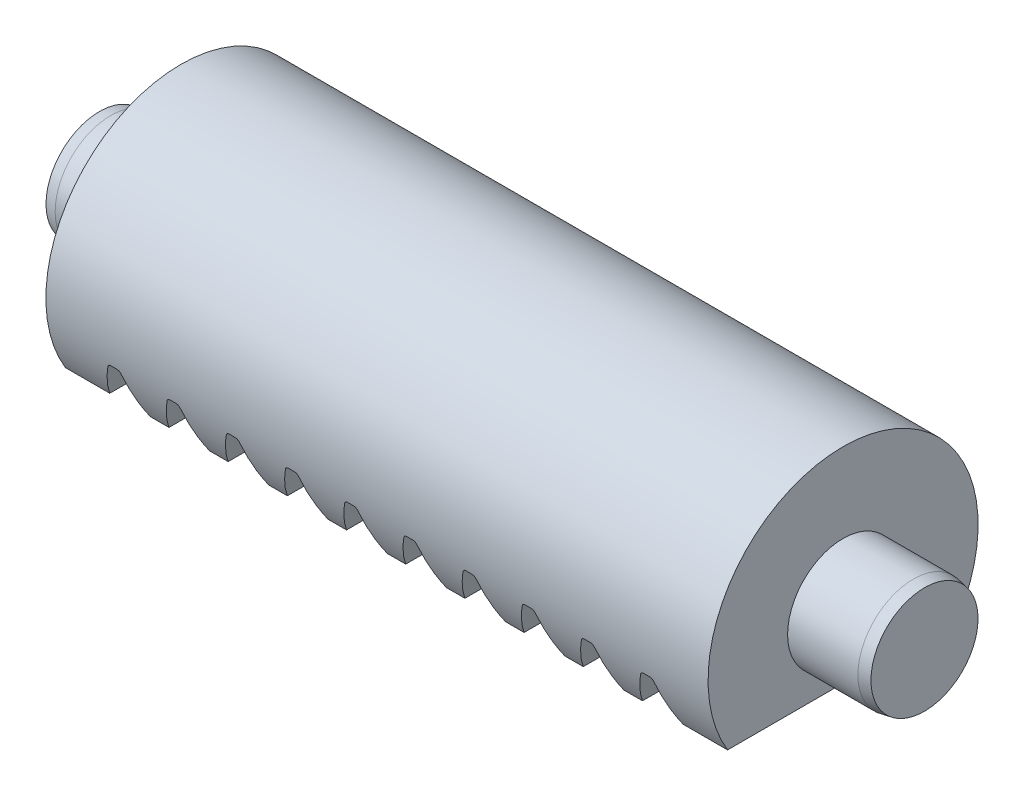
from build123d import *

# Parameters (mm, degrees)
CUT_EXTRUDE_1_DEPTH      = 123.8688325
CUT_EXTRUDE_1_DEPTH_BACK = 123.8688325
SKETCH_2_W               = 179
SKETCH_2_H               = 17.6
CUT_EXTRUDE_2_DEPTH      = 123.8688325
PATTERN_LINEAR_1_COUNT   = 10
PATTERN_LINEAR_1_PITCH   = 16


with BuildPart() as part:
    # Эскиз1 → Повернуть1 (revolve)
    with BuildSketch(Plane.XY, mode=Mode.PRIVATE) as revolve_1_sk:
        Polygon((-111.5, 0), (-111.5, 14.471019058), (-108.5, 15), (-89.5, 15), (-89.5, 36.5), (89.5, 36.5), (89.5, 15), (108.5, 15), (111.5, 14.471019058), (111.5, 0), align=None)
    revolve(revolve_1_sk.sketch.rotate(Axis((-162.765436154, 0, 0), (1, 0, 0)), 90), axis=Axis((-162.765436154, 0, 0), (1, 0, 0)))

    # Эскиз2 → Вырез-Вытянуть1 (cut, two sides: drawn at the far end of the back side and taken through both)
    with BuildSketch(Plane.XY.offset(-CUT_EXTRUDE_1_DEPTH_BACK)):
        with Locations((0, -27.7)):
            Rectangle(SKETCH_2_W, SKETCH_2_H)
    extrude(amount=CUT_EXTRUDE_1_DEPTH + CUT_EXTRUDE_1_DEPTH_BACK, mode=Mode.SUBTRACT)

    # Эскиз3 → Вырез-Вытянуть2 (cut, symmetric)
    with BuildSketch(Plane.XY):
        with BuildLine():
            Line((77.5, -18.9), (73.735812506, -8.557979857))
            ThreePointArc((73.735812506, -8.557979857), (73.369696321, -8.080847956), (72.796119885, -7.9))
            Line((72.796119885, -7.9), (71.203880115, -7.9))
            ThreePointArc((71.203880115, -7.9), (70.630303679, -8.080847956), (70.264187494, -8.557979857))
            Line((70.264187494, -8.557979857), (66.5, -18.9))
            Line((66.5, -18.9), (77.5, -18.9))
        make_face()
    cut_extrude_2 = extrude(amount=CUT_EXTRUDE_2_DEPTH, both=True, mode=Mode.SUBTRACT)

    # Линейный массив1: Вырез-Вытянуть2 ×10
    with Locations(*[(-i * PATTERN_LINEAR_1_PITCH, 0, 0) for i in range(1, PATTERN_LINEAR_1_COUNT)]):
        add(cut_extrude_2, mode=Mode.SUBTRACT)


solid = part.part
